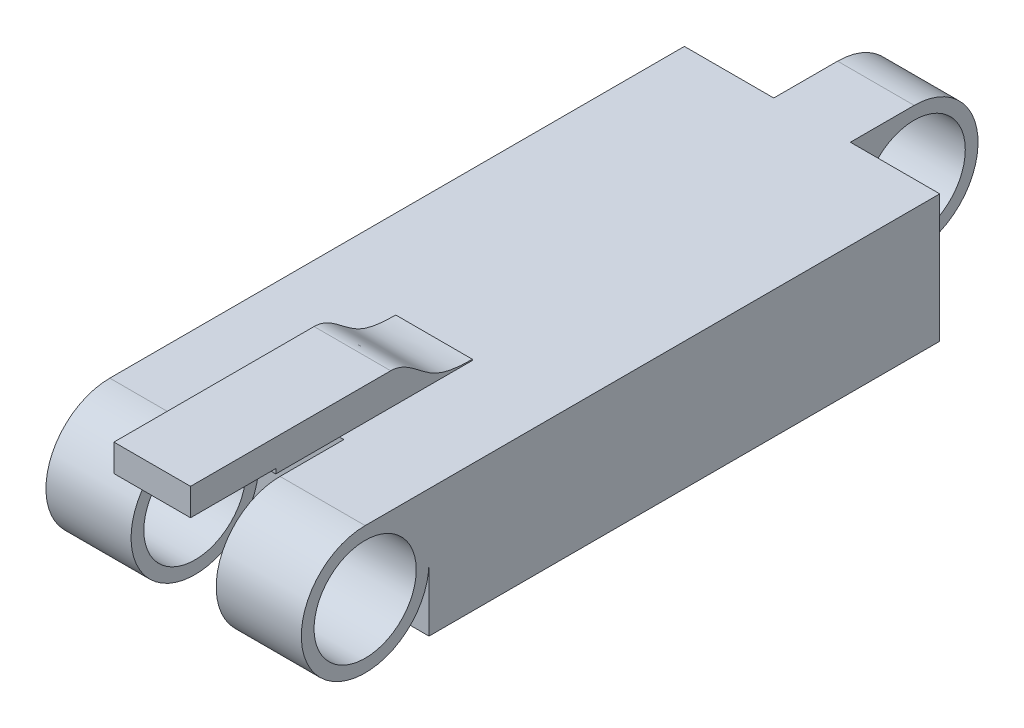
from build123d import *

# Parameters (mm, degrees)
SKETCH2_W                = 20
SKETCH2_H                = 5
BOSS_EXTRUDE1_DEPTH      = 10
SKETCH4_R                = 2
BOSS_EXTRUDE2_DEPTH      = 3.333333333
BOSS_EXTRUDE3_START      = -3.333333333
SKETCH5_R                = 2
BOSS_EXTRUDE3_DEPTH      = 3.333333333
BOSS_EXTRUDE4_DEPTH      = 1.5
BOSS_EXTRUDE4_DEPTH_BACK = 1.5
SKETCH7_R                = 2
BOSS_EXTRUDE5_DEPTH      = 1.5
BOSS_EXTRUDE5_DEPTH_BACK = 1.5
CUT_EXTRUDE1_DEPTH       = 27.57654043


with BuildPart() as part:
    # Sketch2 → Boss-Extrude1 (new body)
    with BuildSketch(Plane(origin=(0, 0, 0), x_dir=(0, 0, -1), z_dir=(1, 0, 0))):
        with Locations((10, 2.5)):
            Rectangle(SKETCH2_W, SKETCH2_H)
    extrude(amount=BOSS_EXTRUDE1_DEPTH)

    # Sketch4 → Boss-Extrude2 (add)
    with BuildSketch(Plane(origin=(10, 0, 0), x_dir=(0, 0, -1), z_dir=(1, 0, 0))):
        with BuildLine():
            Line((-2.5, 5), (0, 5))
            Line((0, 5), (0, 2.5))
            ThreePointArc((0, 2.5), (-4.267766953, 0.732233047), (-2.5, 5))
        make_face()
        with Locations((-2.5, 2.5)):
            Circle(SKETCH4_R, mode=Mode.SUBTRACT)
    extrude(amount=-BOSS_EXTRUDE2_DEPTH)

    # Sketch5 → Boss-Extrude3 (add)
    with BuildSketch(Plane.ZY.offset(BOSS_EXTRUDE3_START)):
        with BuildLine():
            Line((2.5, 5), (0, 5))
            Line((0, 5), (0, 2.5))
            ThreePointArc((0, 2.5), (4.267766953, 0.732233047), (2.5, 5))
        make_face()
        with Locations(Location((2.5, 2.5, 0), (0, 0, 180))):
            Circle(SKETCH5_R, mode=Mode.SUBTRACT)
    extrude(amount=BOSS_EXTRUDE3_DEPTH)

    # Sketch7 → Boss-Extrude4 (add, two sides: drawn at the far end of the back side and taken through both)
    with BuildSketch(Plane(origin=(5, 0, 0), x_dir=(0, 0, -1), z_dir=(1, 0, 0)).offset(-BOSS_EXTRUDE4_DEPTH_BACK)):
        with BuildLine():
            Line((20, 5), (22.5, 5))
            ThreePointArc((22.5, 5), (24.267766953, 0.732233047), (20, 2.5))
            Line((20, 2.5), (20, 5))
        make_face()
        with Locations((22.5, 2.5)):
            Circle(SKETCH7_R, mode=Mode.SUBTRACT)
    extrude(amount=BOSS_EXTRUDE4_DEPTH + BOSS_EXTRUDE4_DEPTH_BACK)

    # Sketch8 → Boss-Extrude5 (add, two sides: drawn at the far end of the back side and taken through both)
    with BuildSketch(Plane(origin=(5, 0, 0), x_dir=(0, 0, -1), z_dir=(1, 0, 0)).offset(-BOSS_EXTRUDE5_DEPTH_BACK)):
        with BuildLine():
            Line((0, 5), (2, 5))
            Line((2, 5), (5.2, 5))
            Line((5.2, 5), (5.2, 5.04))
            add(Edge.make_bspline(
                [(2, 6.25), (2.633677282, 6.25), (3.485069852, 5.13334343), (4.685132782, 5.04), (5.2, 5.04)],
                knots=[0, 0, 0, 0, 0.555540961, 1, 1, 1, 1], degree=3))
            Line((2, 6.25), (-8, 6.25))
            Line((-8, 6.25), (-8, 5))
            Line((-8, 5), (0, 5))
        make_face()
    extrude(amount=BOSS_EXTRUDE5_DEPTH + BOSS_EXTRUDE5_DEPTH_BACK)

    # Sketch9 → Cut-Extrude1 (cut, through all)
    with BuildSketch(Plane.ZY.offset(-3.5)):
        Polygon((8, 6.25), (5.838024107, 6.25), (5.838024107, 5.183121739), (2.5, 5.183121739), (2.5, 5), (8, 5), align=None)
    extrude(amount=-CUT_EXTRUDE1_DEPTH, mode=Mode.SUBTRACT)


solid = part.part
